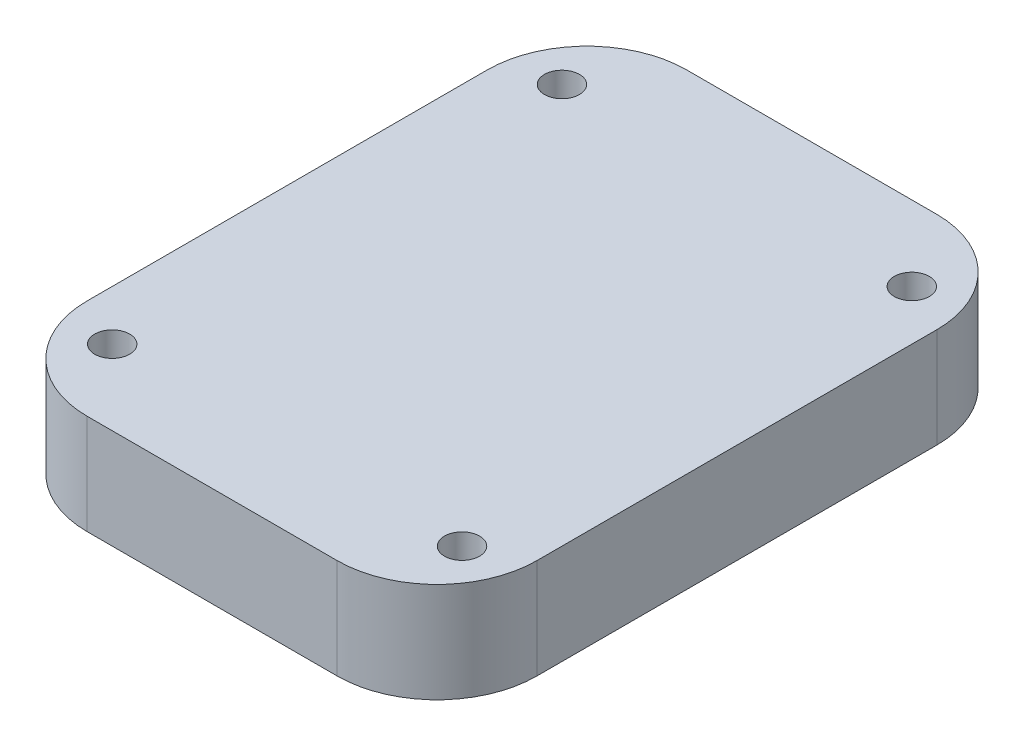
from build123d import *

# Parameters (mm, degrees)
BOSS_EXTRU_1_DEPTH = 10
SKETCH1_R          = 1.75
CUT_EXTRUDE1_DEPTH = 39.810436741


with BuildPart() as part:
    # Esquisse2 → Boss.-Extru.1 (new body)
    with BuildSketch(Plane(origin=(0, 0, 0), x_dir=(1, 0, 0), z_dir=(0, 1, 0))):
        with BuildLine():
            Line((-12.5, 30), (12.5, 30))
            ThreePointArc((12.5, 30), (19.571067812, 27.071067812), (22.5, 20))
            Line((22.5, 20), (22.5, -20))
            ThreePointArc((22.5, -20), (19.571067812, -27.071067812), (12.5, -30))
            Line((12.5, -30), (-12.5, -30))
            ThreePointArc((-12.5, -30), (-19.571067812, -27.071067812), (-22.5, -20))
            Line((-22.5, -20), (-22.5, 20))
            ThreePointArc((-22.5, 20), (-19.571067812, 27.071067812), (-12.5, 30))
        make_face()
    extrude(amount=BOSS_EXTRU_1_DEPTH)

    # Sketch1 → Cut-Extrude1 (cut, through all)
    with BuildSketch(Plane(origin=(0, 10, 0), x_dir=(1, 0, 0), z_dir=(0, 1, 0))):
        with Locations(Location((-17.5, 22.5, 0), (0, 0, 270))):
            Circle(SKETCH1_R)
        with Locations(Location((17.5, 22.5, 0), (0, 0, 270))):
            Circle(SKETCH1_R)
        with Locations(Location((17.5, -22.5, 0), (0, 0, 270))):
            Circle(SKETCH1_R)
        with Locations(Location((-17.5, -22.5, 0), (0, 0, 270))):
            Circle(SKETCH1_R)
    extrude(amount=-CUT_EXTRUDE1_DEPTH, mode=Mode.SUBTRACT)


solid = part.part
